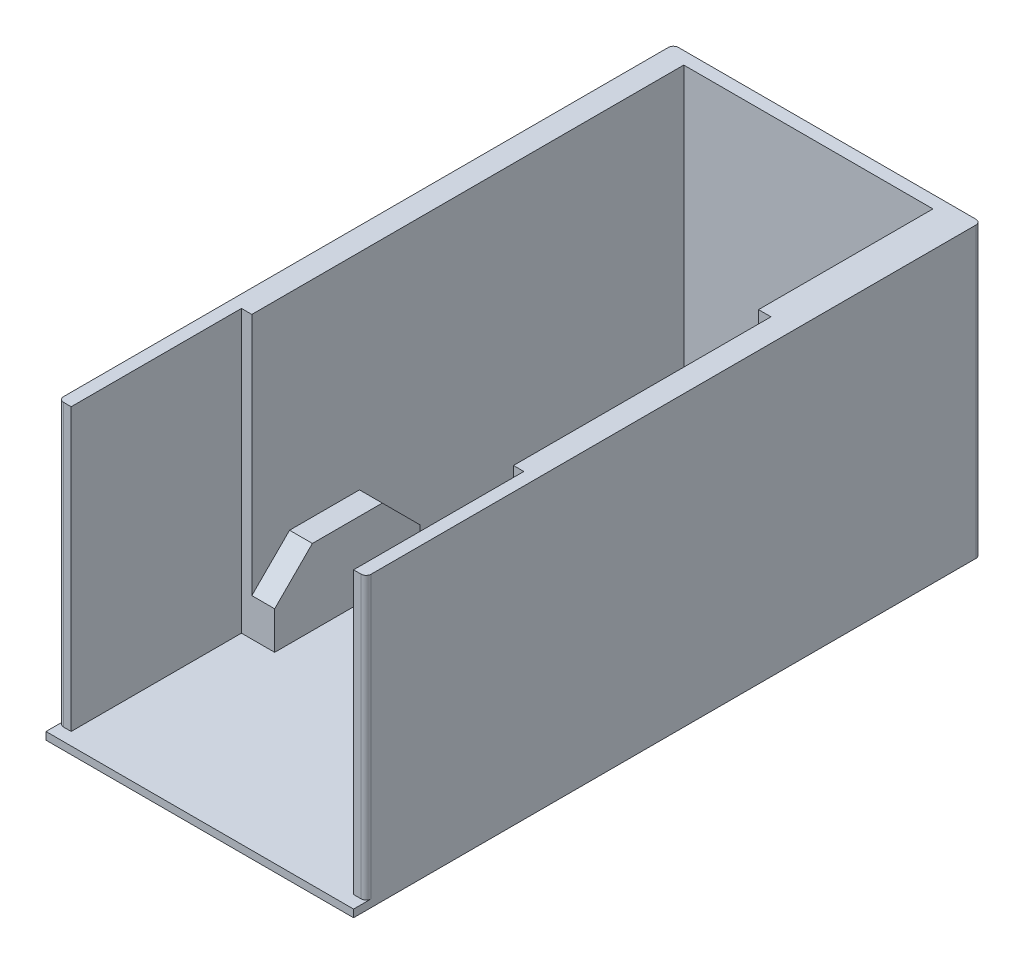
from build123d import *

# Parameters (mm, degrees)
BOSS_EXTRUDE1_DEPTH = 111.8
SKETCH7_W           = 122.268
SKETCH7_H           = 249.395
BOSS_EXTRUDE2_DEPTH = 3
SKETCH8_W           = 9.0805
SKETCH8_H           = 57.785
BOSS_EXTRUDE3_DEPTH = 30
CUT_EXTRUDE1_DEPTH  = 9.0805
CUT_EXTRUDE2_DEPTH  = 9.0805
FILLET1_R           = 2


with BuildPart() as part:
    # Sketch6 → Boss-Extrude1 (new body)
    with BuildSketch(Plane(origin=(0, 0, 0), x_dir=(1, 0, 0), z_dir=(0, 1, 0))):
        Polygon((-809.2275, 2922.905), (-804.2275, 2922.905), (-804.2275, 2990.596), (-800.1, 2990.596), (-800.1, 3162.3), (-701.04, 3162.3), (-701.04, 3092.958), (-696.087, 3092.958), (-696.087, 2990.596), (-691.9595, 2990.596), (-691.9595, 2922.905), (-686.9595, 2922.905), (-686.9595, 3167.3), (-809.2275, 3167.3), align=None)
    extrude(amount=BOSS_EXTRUDE1_DEPTH)

    # Sketch7 → Boss-Extrude2 (add)
    with BuildSketch(Plane.XZ):
        with Locations((-748.0935, -3042.6025)):
            Rectangle(SKETCH7_W, SKETCH7_H)
    extrude(amount=BOSS_EXTRUDE2_DEPTH)

    # Sketch8 → Boss-Extrude3 (add)
    with BuildSketch(Plane(origin=(0, 0, 0), x_dir=(1, 0, 0), z_dir=(0, 1, 0))):
        with Locations((-795.55975, 3019.4885)):
            Rectangle(SKETCH8_W, SKETCH8_H)
        with Locations((-700.62725, 3019.4885)):
            Rectangle(SKETCH8_W, SKETCH8_H)
    extrude(amount=BOSS_EXTRUDE3_DEPTH)

    # Sketch9 → Cut-Extrude1 (cut)
    with BuildSketch(Plane(origin=(-791.0195, 0, 0), x_dir=(0, 0, -1), z_dir=(1, 0, 0))):
        Polygon((2990.596, 30), (2990.596, 15), (3005.596, 30), align=None)
        Polygon((3048.381, 30), (3033.381, 30), (3048.381, 15), align=None)
    extrude(amount=-CUT_EXTRUDE1_DEPTH, mode=Mode.SUBTRACT)

    # Sketch10 → Cut-Extrude2 (cut)
    with BuildSketch(Plane.ZY.offset(705.1675)):
        Polygon((-3048.381, 30), (-3048.381, 15), (-3033.381, 30), align=None)
        Polygon((-2990.596, 30), (-3005.596, 30), (-2990.596, 15), align=None)
    extrude(amount=-CUT_EXTRUDE2_DEPTH, mode=Mode.SUBTRACT)

    # Fillet1
    fillet1_edges = [part.edges().sort_by_distance(p)[0] for p in [
        (-809.2275, 55.9, -2922.905),
        (-809.2275, 54.4, -3167.3),
        (-686.9595, 54.4, -3167.3),
        (-686.9595, 55.9, -2922.905),
    ]]
    fillet(fillet1_edges, radius=FILLET1_R)


solid = part.part
